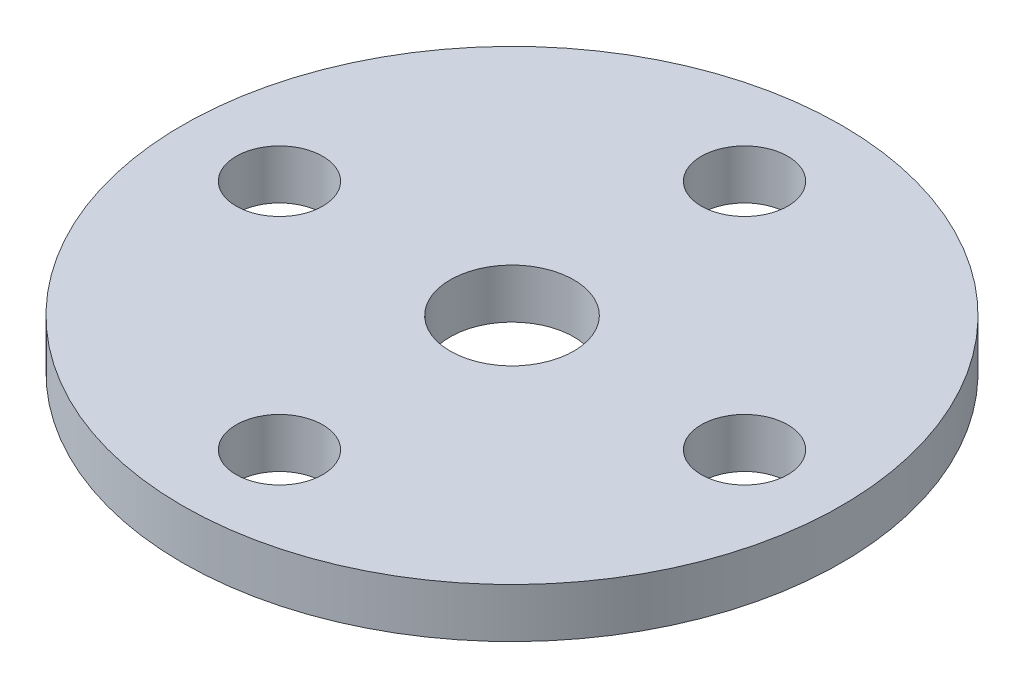
from build123d import *

# Parameters (mm, degrees)
SKETCH_1_R          = 16
EXTRUDE_1_DEPTH     = 2.4
CUT_EXTRUDE_2_REACH = 24.754
SKETCH_4_R          = 2.1
CUT_EXTRUDE_3_REACH = 24.754
SKETCH_2_R          = 3


with BuildPart() as part:
    # 草圖1 → 填料-伸長1 (new body)
    with BuildSketch(Plane(origin=(0, 0, 0), x_dir=(1, 0, 0), z_dir=(0, 1, 0))):
        with Locations(Location((0, 0, 0), (0, 0, 270))):
            Circle(SKETCH_1_R)
    extrude(amount=EXTRUDE_1_DEPTH)

    # 草圖4 → 除料-伸長2 (cut, up to next)
    with BuildSketch(Plane(origin=(0, 2.4, 0), x_dir=(1, 0, 0), z_dir=(0, 1, 0)), mode=Mode.PRIVATE) as cut_extrude_2_sk1:
        with Locations(Location((0, 11.29, 0), (0, 0, 270))):
            Circle(SKETCH_4_R)
    cut_extrude_2_tool1 = extrude(cut_extrude_2_sk1.sketch, amount=-CUT_EXTRUDE_2_REACH, mode=Mode.PRIVATE) & part.part
    # 草圖4 → 除料-伸長2 (cut, up to next)
    with BuildSketch(Plane(origin=(0, 2.4, 0), x_dir=(1, 0, 0), z_dir=(0, 1, 0)), mode=Mode.PRIVATE) as cut_extrude_2_sk2:
        with Locations(Location((11.29, 0, 0), (0, 0, 270))):
            Circle(SKETCH_4_R)
    cut_extrude_2_tool2 = extrude(cut_extrude_2_sk2.sketch, amount=-CUT_EXTRUDE_2_REACH, mode=Mode.PRIVATE) & part.part
    # 草圖4 → 除料-伸長2 (cut, up to next)
    with BuildSketch(Plane(origin=(0, 2.4, 0), x_dir=(1, 0, 0), z_dir=(0, 1, 0)), mode=Mode.PRIVATE) as cut_extrude_2_sk3:
        with Locations(Location((0, -11.29, 0), (0, 0, 270))):
            Circle(SKETCH_4_R)
    cut_extrude_2_tool3 = extrude(cut_extrude_2_sk3.sketch, amount=-CUT_EXTRUDE_2_REACH, mode=Mode.PRIVATE) & part.part
    # 草圖4 → 除料-伸長2 (cut, up to next)
    with BuildSketch(Plane(origin=(0, 2.4, 0), x_dir=(1, 0, 0), z_dir=(0, 1, 0)), mode=Mode.PRIVATE) as cut_extrude_2_sk4:
        with Locations(Location((-11.29, 0, 0), (0, 0, 270))):
            Circle(SKETCH_4_R)
    cut_extrude_2_tool4 = extrude(cut_extrude_2_sk4.sketch, amount=-CUT_EXTRUDE_2_REACH, mode=Mode.PRIVATE) & part.part
    add(cut_extrude_2_tool1.solids().sort_by_distance((0, 2.4, -11.29))[0], mode=Mode.SUBTRACT)
    add(cut_extrude_2_tool2.solids().sort_by_distance((11.29, 2.4, 0))[0], mode=Mode.SUBTRACT)
    add(cut_extrude_2_tool3.solids().sort_by_distance((0, 2.4, 11.29))[0], mode=Mode.SUBTRACT)
    add(cut_extrude_2_tool4.solids().sort_by_distance((-11.29, 2.4, 0))[0], mode=Mode.SUBTRACT)

    # 草圖2 → 除料-伸長3 (cut, up to next)
    with BuildSketch(Plane(origin=(0, 2.4, 0), x_dir=(1, 0, 0), z_dir=(0, 1, 0)), mode=Mode.PRIVATE) as cut_extrude_3_sk1:
        with Locations(Location((0, 0, 0), (0, 0, 270))):
            Circle(SKETCH_2_R)
    cut_extrude_3_tool1 = extrude(cut_extrude_3_sk1.sketch, amount=-CUT_EXTRUDE_3_REACH, mode=Mode.PRIVATE) & part.part
    add(cut_extrude_3_tool1.solids().sort_by_distance((0, 2.4, 0))[0], mode=Mode.SUBTRACT)


solid = part.part
